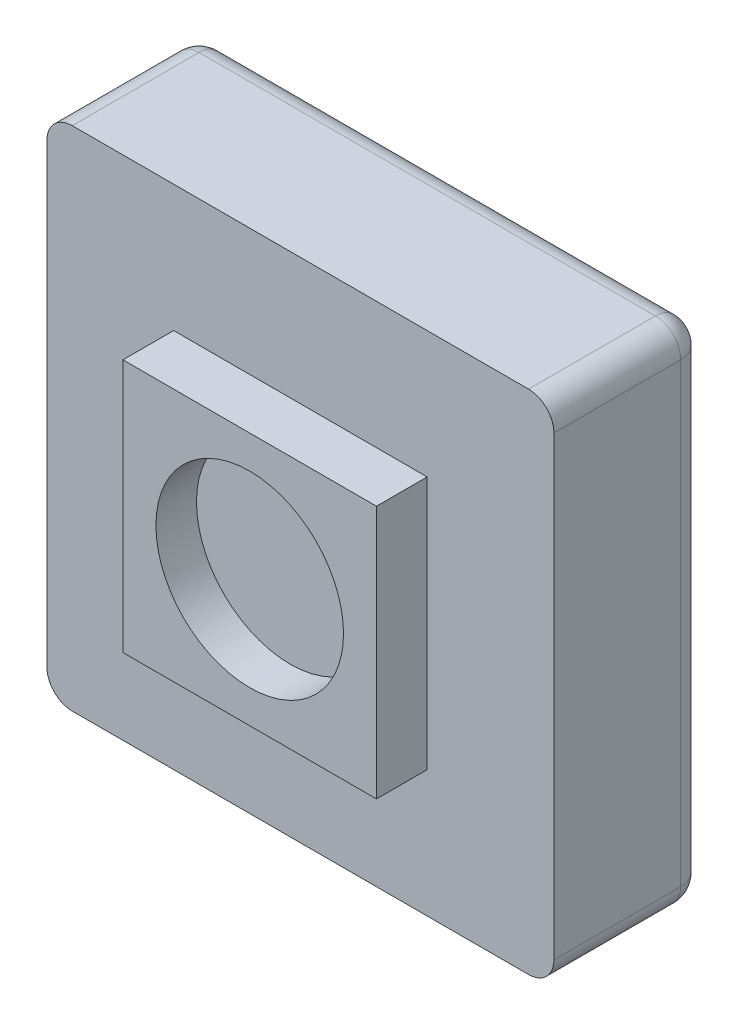
from build123d import *

# Parameters (mm, degrees)
SKETCH1_W           = 10
SKETCH1_H           = 10
BOSS_EXTRUDE1_DEPTH = 3
SKETCH2_W           = 5
SKETCH2_H           = 5
BOSS_EXTRUDE2_DEPTH = 1
SKETCH3_R           = 1.85
CUT_EXTRUDE1_DEPTH  = 0.8
FILLET1_R           = 0.5
FILLET2_R           = 0.5


with BuildPart() as part:
    # Sketch1 → Boss-Extrude1 (new body)
    with BuildSketch(Plane.XY):
        Rectangle(SKETCH1_W, SKETCH1_H)
    extrude(amount=BOSS_EXTRUDE1_DEPTH)

    # Sketch2 → Boss-Extrude2 (add)
    with BuildSketch(Plane.XY.offset(3)):
        Rectangle(SKETCH2_W, SKETCH2_H)
    extrude(amount=BOSS_EXTRUDE2_DEPTH)

    # Sketch3 → Cut-Extrude1 (cut)
    with BuildSketch(Plane.XY.offset(4)):
        Circle(SKETCH3_R)
    extrude(amount=-CUT_EXTRUDE1_DEPTH, mode=Mode.SUBTRACT)

    # Fillet1
    fillet1_edges = [part.edges().sort_by_distance(p)[0] for p in [
        (5, -5, 1.5),
        (-5, -5, 1.5),
        (-5, 5, 1.5),
        (5, 5, 1.5),
    ]]
    fillet(fillet1_edges, radius=FILLET1_R)

    # Fillet2
    fillet2_edges = [part.edges().sort_by_distance(p)[0] for p in [
        (0, -5, 0),
        (5, 0, 0),
        (-5, 0, 0),
        (0, 5, 0),
        (4.853553391, -4.853553391, 0),
        (4.853553391, 4.853553391, 0),
        (-4.853553391, 4.853553391, 0),
        (-4.853553391, -4.853553391, 0),
    ]]
    fillet(fillet2_edges, radius=FILLET2_R)


solid = part.part
